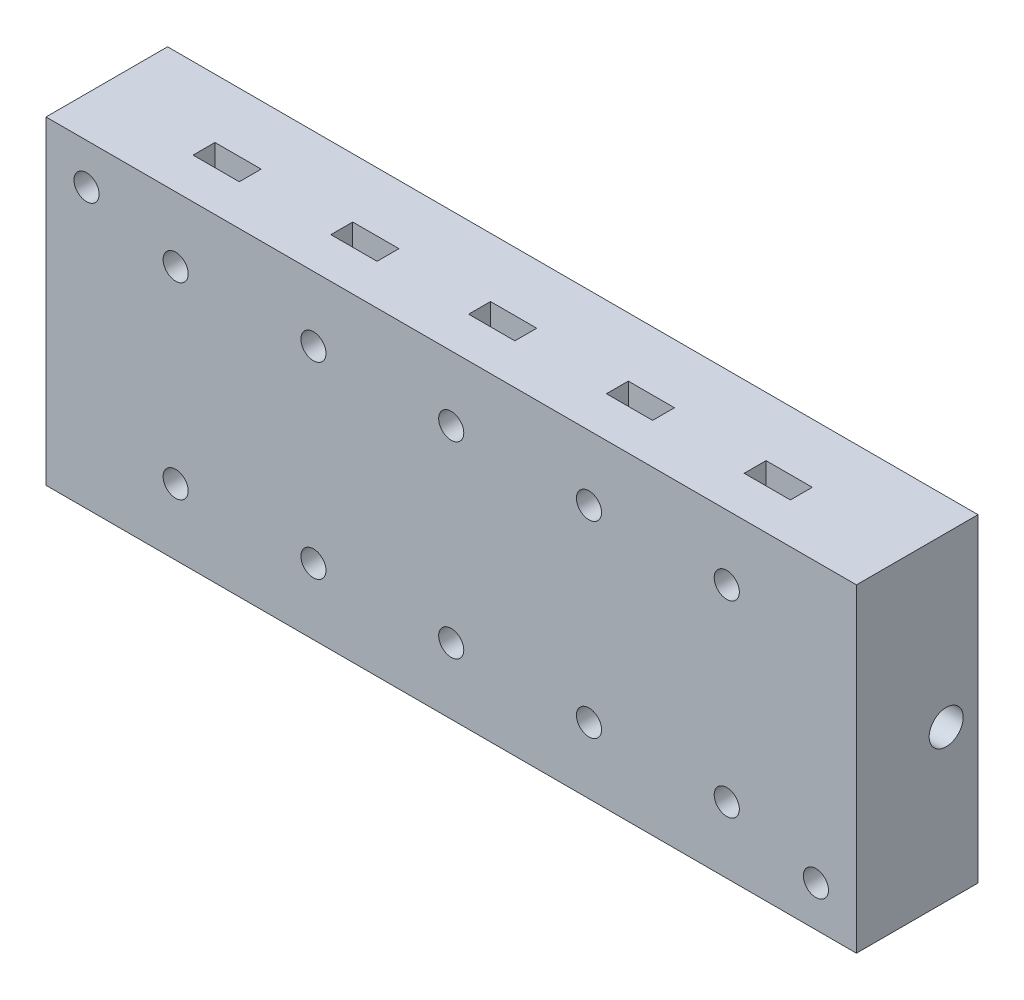
from build123d import *

# Parameters (mm, degrees)
SKIZZE2_W                            = 100
SKIZZE2_H                            = 39.364160046
AUFSATZ_LINEAR_AUSTRAGEN1_DEPTH      = 30
SCHNITT_LINEAR_AUSTRAGEN1_DEPTH      = 40
SCHNITT_LINEAR_AUSTRAGEN1_DEPTH_BACK = 40
SKIZZE10_R                           = 5
SKIZZE17_R                           = 1.55
SCHNITT_LINEAR_AUSTRAGEN2_DEPTH      = 3
SKIZZE24_R                           = 1.55
SCHNITT_LINEAR_AUSTRAGEN4_DEPTH      = 112.577493681
SKIZZE37_R                           = 0.736865544
SCHNITT_LINEAR_AUSTRAGEN9_DEPTH      = 112.577493681
SKIZZE40_R                           = 2.1
SCHNITT_LINEAR_AUSTRAGEN10_DEPTH     = 6
SKIZZE42_R                           = 0.75
SCHNITT_LINEAR_AUSTRAGEN12_DEPTH     = 10
SKIZZE46_R                           = 2.85
SCHNITT_LINEAR_AUSTRAGEN15_DEPTH     = 10
SCHNITT_LINEAR_START                 = -5
SCHNITT_LINEAR_AUSTRAGEN25_DEPTH     = 2.7
LINEARES_MUSTER1_COUNT               = 5
LINEARES_MUSTER1_PITCH               = 17
SPIEGELN2_COPY_1_SKETCH_R            = 2.85
SPIEGELN2_COPY_1_DEPTH               = 10
SPIEGELN2_COPY_2_SKETCH_R            = 2.85
SPIEGELN2_COPY_2_DEPTH               = 10
SPIEGELN2_COPY_3_SKETCH_R            = 2.85
SPIEGELN2_COPY_3_DEPTH               = 10
SPIEGELN2_COPY_4_SKETCH_R            = 2.85
SPIEGELN2_COPY_4_DEPTH               = 10
SPIEGELN2_START                      = -5
SPIEGELN2_COPY_5_DEPTH               = 2.7
SPIEGELN2_COPY_6_DEPTH               = 2.7
SPIEGELN2_COPY_7_DEPTH               = 2.7
SPIEGELN2_COPY_8_DEPTH               = 2.7
SKIZZE51_R                           = 1.55
SCHNITT_LINEAR_AUSTRAGEN26_DEPTH     = 112.577493681
SKIZZE55_R                           = 0.5
SCHNITT_LINEAR_AUSTRAGEN28_DEPTH     = 112.577493681
SKIZZE59_R                           = 2.05
SCHNITT_LINEAR_AUSTRAGEN30_DEPTH     = 5
FASE1_SIZE                           = 1
FASE2_SIZE                           = 1
ABSPALTEN3_SURFACE_1_BACK            = 112.577
ABSPALTEN3_SURFACE_1_DEPTH           = 225.154


with BuildPart() as part:
    # Skizze2 → Aufsatz-Linear austragen1 (new body)
    with BuildSketch(Plane.XY):
        with Locations((50, 19.682080023)):
            Rectangle(SKIZZE2_W, SKIZZE2_H)
    extrude(amount=AUFSATZ_LINEAR_AUSTRAGEN1_DEPTH)

    # Skizze10 → Schnitt-Linear austragen1 (cut, two sides: drawn at the far end of the back side and taken through both)
    with BuildSketch(Plane.ZY.offset(-50).offset(-SCHNITT_LINEAR_AUSTRAGEN1_DEPTH_BACK)):
        with Locations((14.945770016, 20.027045739)):
            Circle(SKIZZE10_R)
    extrude(amount=SCHNITT_LINEAR_AUSTRAGEN1_DEPTH + SCHNITT_LINEAR_AUSTRAGEN1_DEPTH_BACK, mode=Mode.SUBTRACT)

    # Skizze17 → Schnitt-Linear austragen2 (cut)
    with BuildSketch(Plane.ZY.offset(-90)):
        with Locations((14.945770016, 20.027045739)):
            Circle(SKIZZE17_R)
    schnitt_linear_austragen2 = extrude(amount=-SCHNITT_LINEAR_AUSTRAGEN2_DEPTH, mode=Mode.SUBTRACT)

    # Spiegeln1: Schnitt-Linear austragen2 across plane
    add(schnitt_linear_austragen2.mirror(Plane.ZY.offset(-50)), mode=Mode.SUBTRACT)

    # Skizze24 → Schnitt-Linear austragen4 (cut, through all)
    with BuildSketch(Plane.XY.offset(30)):
        with Locations((16, 31.364160046)):
            Circle(SKIZZE24_R)
        with Locations((33, 31.364160046)):
            Circle(SKIZZE24_R)
        with Locations((50, 31.364160046)):
            Circle(SKIZZE24_R)
        with Locations((67, 31.364160046)):
            Circle(SKIZZE24_R)
        with Locations((84, 31.364160046)):
            Circle(SKIZZE24_R)
    schnitt_linear_austragen4 = extrude(amount=-SCHNITT_LINEAR_AUSTRAGEN4_DEPTH, mode=Mode.SUBTRACT)

    # Skizze37 → Schnitt-Linear austragen9 (cut, through all)
    with BuildSketch(Plane(origin=(100, 0, 0), x_dir=(0, 0, -1), z_dir=(1, 0, 0))):
        with Locations((-18.924590299, 18.633559666)):
            Circle(SKIZZE37_R)
    extrude(amount=-SCHNITT_LINEAR_AUSTRAGEN9_DEPTH, mode=Mode.SUBTRACT)

    # Skizze40 → Schnitt-Linear austragen10 (cut)
    with BuildSketch(Plane(origin=(100, 0, 0), x_dir=(0, 0, -1), z_dir=(1, 0, 0))):
        with Locations((-18.924590299, 18.633559666)):
            Circle(SKIZZE40_R)
    extrude(amount=-SCHNITT_LINEAR_AUSTRAGEN10_DEPTH, mode=Mode.SUBTRACT)

    # Skizze42 → Schnitt-Linear austragen12 (cut)
    with BuildSketch(Plane.ZY):
        with Locations((10.86415918, 18.842582577)):
            Circle(SKIZZE42_R)
    extrude(amount=-SCHNITT_LINEAR_AUSTRAGEN12_DEPTH, mode=Mode.SUBTRACT)

    # Skizze46 → Schnitt-Linear austragen15 (cut)
    with BuildSketch(Plane(origin=(0, 0, 0), x_dir=(-1, 0, 0), z_dir=(0, 0, -1))):
        with Locations((-84, 31.364160046)):
            Circle(SKIZZE46_R)
    schnitt_linear_austragen15 = extrude(amount=-SCHNITT_LINEAR_AUSTRAGEN15_DEPTH, mode=Mode.SUBTRACT)

    # Skizze50 → Schnitt-Linear austragen25 (cut)
    with BuildSketch(Plane.XY.offset(30).offset(SCHNITT_LINEAR_START)):
        Polygon((81.15, 33.009608314), (81.15, 39.364160046), (86.85, 39.364160046), (86.85, 33.009608314), (86.85, 29.718711779), (84, 28.073263512), (81.15, 29.718711779), align=None)
    schnitt_linear_austragen25 = extrude(amount=-SCHNITT_LINEAR_AUSTRAGEN25_DEPTH, mode=Mode.SUBTRACT)

    # Lineares Muster1: Schnitt-Linear austragen15, Schnitt-Linear austragen25 ×5
    with Locations(*[(-i * LINEARES_MUSTER1_PITCH, 0, 0) for i in range(1, LINEARES_MUSTER1_COUNT)]):
        add(schnitt_linear_austragen15, mode=Mode.SUBTRACT)
        add(schnitt_linear_austragen25, mode=Mode.SUBTRACT)

    # Spiegeln2: Schnitt-Linear austragen15, Schnitt-Linear austragen25 across plane
    add(schnitt_linear_austragen15.mirror(Plane.ZX.offset(19.764160046)), mode=Mode.SUBTRACT)
    add(schnitt_linear_austragen25.mirror(Plane.ZX.offset(19.764160046)), mode=Mode.SUBTRACT)

    # Spiegeln2 copy 1 sketch → Spiegeln2 copy 1 (cut)
    with BuildSketch(Plane(origin=(-17, 39.528320093, 0), x_dir=(-1, 0, 0), z_dir=(0, 0, -1))):
        with Locations((-84, -31.364160046)):
            Circle(SPIEGELN2_COPY_1_SKETCH_R)
    extrude(amount=-SPIEGELN2_COPY_1_DEPTH, mode=Mode.SUBTRACT)

    # Spiegeln2 copy 2 sketch → Spiegeln2 copy 2 (cut)
    with BuildSketch(Plane(origin=(-34, 39.528320093, 0), x_dir=(-1, 0, 0), z_dir=(0, 0, -1))):
        with Locations((-84, -31.364160046)):
            Circle(SPIEGELN2_COPY_2_SKETCH_R)
    extrude(amount=-SPIEGELN2_COPY_2_DEPTH, mode=Mode.SUBTRACT)

    # Spiegeln2 copy 3 sketch → Spiegeln2 copy 3 (cut)
    with BuildSketch(Plane(origin=(-51, 39.528320093, 0), x_dir=(-1, 0, 0), z_dir=(0, 0, -1))):
        with Locations((-84, -31.364160046)):
            Circle(SPIEGELN2_COPY_3_SKETCH_R)
    extrude(amount=-SPIEGELN2_COPY_3_DEPTH, mode=Mode.SUBTRACT)

    # Spiegeln2 copy 4 sketch → Spiegeln2 copy 4 (cut)
    with BuildSketch(Plane(origin=(-68, 39.528320093, 0), x_dir=(-1, 0, 0), z_dir=(0, 0, -1))):
        with Locations((-84, -31.364160046)):
            Circle(SPIEGELN2_COPY_4_SKETCH_R)
    extrude(amount=-SPIEGELN2_COPY_4_DEPTH, mode=Mode.SUBTRACT)

    # Spiegeln2 copy 5 sketch → Spiegeln2 copy 5 (cut)
    with BuildSketch(Plane(origin=(-17, 39.528320093, 30), x_dir=(1, 0, 0), z_dir=(0, 0, 1)).offset(SPIEGELN2_START)):
        Polygon((81.15, -33.009608314), (81.15, -39.364160046), (86.85, -39.364160046), (86.85, -33.009608314), (86.85, -29.718711779), (84, -28.073263512), (81.15, -29.718711779), align=None)
    extrude(amount=-SPIEGELN2_COPY_5_DEPTH, mode=Mode.SUBTRACT)

    # Spiegeln2 copy 6 sketch → Spiegeln2 copy 6 (cut)
    with BuildSketch(Plane(origin=(-34, 39.528320093, 30), x_dir=(1, 0, 0), z_dir=(0, 0, 1)).offset(SPIEGELN2_START)):
        Polygon((81.15, -33.009608314), (81.15, -39.364160046), (86.85, -39.364160046), (86.85, -33.009608314), (86.85, -29.718711779), (84, -28.073263512), (81.15, -29.718711779), align=None)
    extrude(amount=-SPIEGELN2_COPY_6_DEPTH, mode=Mode.SUBTRACT)

    # Spiegeln2 copy 7 sketch → Spiegeln2 copy 7 (cut)
    with BuildSketch(Plane(origin=(-51, 39.528320093, 30), x_dir=(1, 0, 0), z_dir=(0, 0, 1)).offset(SPIEGELN2_START)):
        Polygon((81.15, -33.009608314), (81.15, -39.364160046), (86.85, -39.364160046), (86.85, -33.009608314), (86.85, -29.718711779), (84, -28.073263512), (81.15, -29.718711779), align=None)
    extrude(amount=-SPIEGELN2_COPY_7_DEPTH, mode=Mode.SUBTRACT)

    # Spiegeln2 copy 8 sketch → Spiegeln2 copy 8 (cut)
    with BuildSketch(Plane(origin=(-68, 39.528320093, 30), x_dir=(1, 0, 0), z_dir=(0, 0, 1)).offset(SPIEGELN2_START)):
        Polygon((81.15, -33.009608314), (81.15, -39.364160046), (86.85, -39.364160046), (86.85, -33.009608314), (86.85, -29.718711779), (84, -28.073263512), (81.15, -29.718711779), align=None)
    extrude(amount=-SPIEGELN2_COPY_8_DEPTH, mode=Mode.SUBTRACT)

    # Spiegeln3: Schnitt-Linear austragen4 across plane
    add(schnitt_linear_austragen4.mirror(Plane.ZX.offset(19.764160046)), mode=Mode.SUBTRACT)

    # Skizze51 → Schnitt-Linear austragen26 (cut, through all)
    with BuildSketch(Plane.XY.offset(30)):
        with Locations((5, 34.364160046)):
            Circle(SKIZZE51_R)
        with Locations((95, 5)):
            Circle(SKIZZE51_R)
    extrude(amount=-SCHNITT_LINEAR_AUSTRAGEN26_DEPTH, mode=Mode.SUBTRACT)

    # Skizze55 → Schnitt-Linear austragen28 (cut, through all)
    with BuildSketch(Plane(origin=(100, 0, 0), x_dir=(0, 0, -1), z_dir=(1, 0, 0))):
        with Locations((-12.633679338, 21.083160509)):
            Circle(SKIZZE55_R)
    extrude(amount=-SCHNITT_LINEAR_AUSTRAGEN28_DEPTH, mode=Mode.SUBTRACT)

    # Skizze59 → Schnitt-Linear austragen30 (cut)
    with BuildSketch(Plane(origin=(100, 0, 0), x_dir=(0, 0, -1), z_dir=(1, 0, 0))):
        with Locations((-12.633679338, 21.083160509)):
            Circle(SKIZZE59_R)
    extrude(amount=-SCHNITT_LINEAR_AUSTRAGEN30_DEPTH, mode=Mode.SUBTRACT)

    # Fase1
    fase1_edges = [part.edges().sort_by_distance(p)[0] for p in [
        (94, 18.633559666, 19.661455843),
    ]]
    chamfer(fase1_edges, length=FASE1_SIZE)

    # Fase2
    fase2_edges = [part.edges().sort_by_distance(p)[0] for p in [
        (95, 21.083160509, 13.133679338),
    ]]
    chamfer(fase2_edges, length=FASE2_SIZE)

    # Abspalten3: cut with a surface, the side it looks to stays
    # Abspalten3 surface: a surface, the sketch's curves swept straight by 225.154 mm
    with BuildLine(Plane(origin=(100, 0, 0), x_dir=(0, 0, -1), z_dir=(1, 0, 0)).offset(-ABSPALTEN3_SURFACE_1_BACK), mode=Mode.PRIVATE) as abspalten3_surface_1_path:
        Line((-15, 39.364160046), (0, 39.364160046))
        Line((0, 39.364160046), (0, 0))
        Line((0, 0), (-15, 0))
        Line((-15, 0), (-15, 39.364160046))
    abspalten3_surface_1 = Shell.extrude(abspalten3_surface_1_path.wire(), (1 * ABSPALTEN3_SURFACE_1_DEPTH, 0 * ABSPALTEN3_SURFACE_1_DEPTH, 0 * ABSPALTEN3_SURFACE_1_DEPTH))
    split(bisect_by=abspalten3_surface_1, keep=Keep.TOP)


solid = part.part
